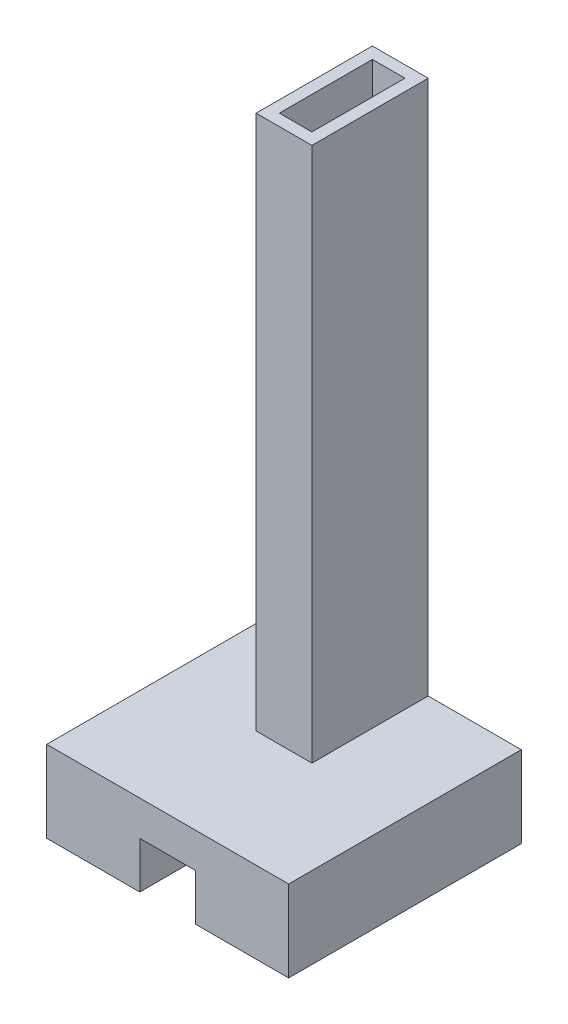
from build123d import *

# Parameters (mm, degrees)
SKIZZE1_W                       = 1040
SKIZZE1_H                       = 350
AUFSATZ_LINEAR_AUSTRAGEN1_DEPTH = 1000
SKIZZE2_W                       = 240
SKIZZE2_H                       = 200
SCHNITT_LINEAR_AUSTRAGEN1_DEPTH = 1485.621163799
SKIZZE3_W                       = 240
SKIZZE3_H                       = 500
AUFSATZ_LINEAR_AUSTRAGEN2_DEPTH = 2300
SKIZZE4_W                       = 140
SKIZZE4_H                       = 400
SCHNITT_LINEAR_AUSTRAGEN2_DEPTH = 3018.300117655


with BuildPart() as part:
    # Skizze1 → Aufsatz-Linear austragen1 (new body)
    with BuildSketch(Plane.XY):
        with Locations((520, 175)):
            Rectangle(SKIZZE1_W, SKIZZE1_H)
    extrude(amount=AUFSATZ_LINEAR_AUSTRAGEN1_DEPTH)

    # Skizze2 → Schnitt-Linear austragen1 (cut, through all)
    with BuildSketch(Plane.XY.offset(1000)):
        with Locations((520, 100)):
            Rectangle(SKIZZE2_W, SKIZZE2_H)
    extrude(amount=-SCHNITT_LINEAR_AUSTRAGEN1_DEPTH, mode=Mode.SUBTRACT)

    # Skizze3 → Aufsatz-Linear austragen2 (add)
    with BuildSketch(Plane(origin=(0, 350, 0), x_dir=(1, 0, 0), z_dir=(0, 1, 0))):
        with Locations((520, -250)):
            Rectangle(SKIZZE3_W, SKIZZE3_H)
    extrude(amount=AUFSATZ_LINEAR_AUSTRAGEN2_DEPTH)

    # Skizze4 → Schnitt-Linear austragen2 (cut, through all)
    with BuildSketch(Plane(origin=(0, 2650, 0), x_dir=(1, 0, 0), z_dir=(0, 1, 0))):
        with Locations((520, -250)):
            Rectangle(SKIZZE4_W, SKIZZE4_H)
    extrude(amount=-SCHNITT_LINEAR_AUSTRAGEN2_DEPTH, mode=Mode.SUBTRACT)


solid = part.part
